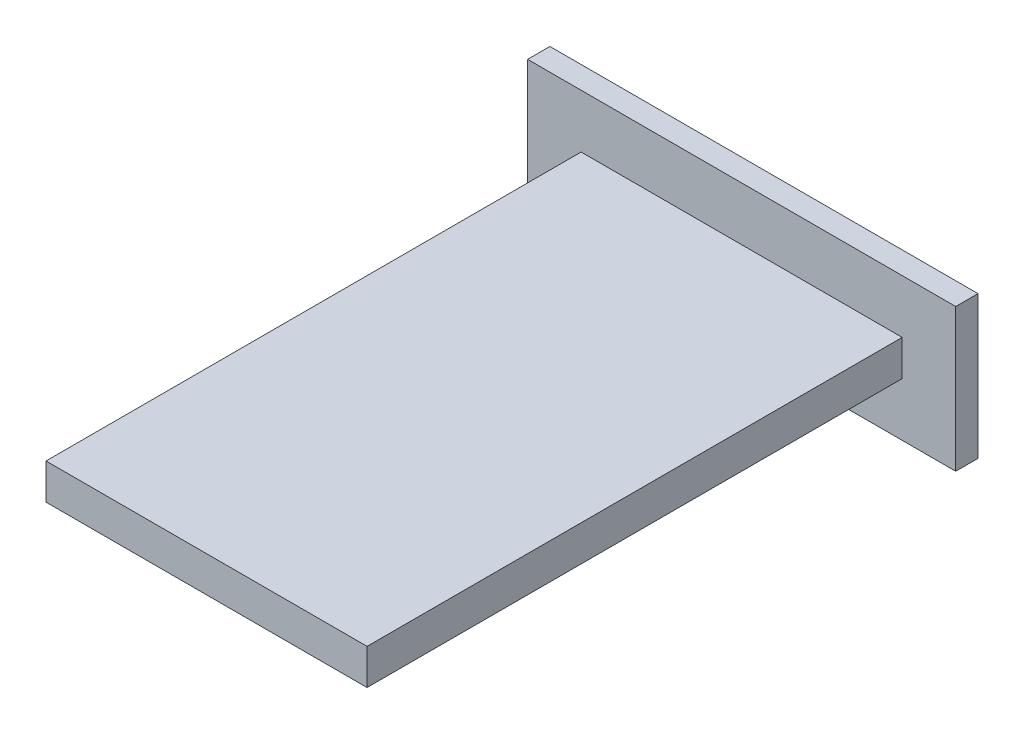
from build123d import *

# Parameters (mm, degrees)
SKETCH1_W           = 18
SKETCH1_H           = 30
BOSS_EXTRUDE1_DEPTH = 2
SKETCH2_W           = 24
SKETCH2_H           = 8
BOSS_EXTRUDE2_DEPTH = 1.25


with BuildPart() as part:
    # Sketch1 → Boss-Extrude1 (new body)
    with BuildSketch(Plane(origin=(0, 0, 0), x_dir=(1, 0, 0), z_dir=(0, 1, 0))):
        Rectangle(SKETCH1_W, SKETCH1_H)
    extrude(amount=BOSS_EXTRUDE1_DEPTH)

    # Sketch2 → Boss-Extrude2 (add)
    with BuildSketch(Plane(origin=(0, 0, -15), x_dir=(-1, 0, 0), z_dir=(0, 0, -1))):
        with Locations((0, 1)):
            Rectangle(SKETCH2_W, SKETCH2_H)
    extrude(amount=BOSS_EXTRUDE2_DEPTH)


solid = part.part
